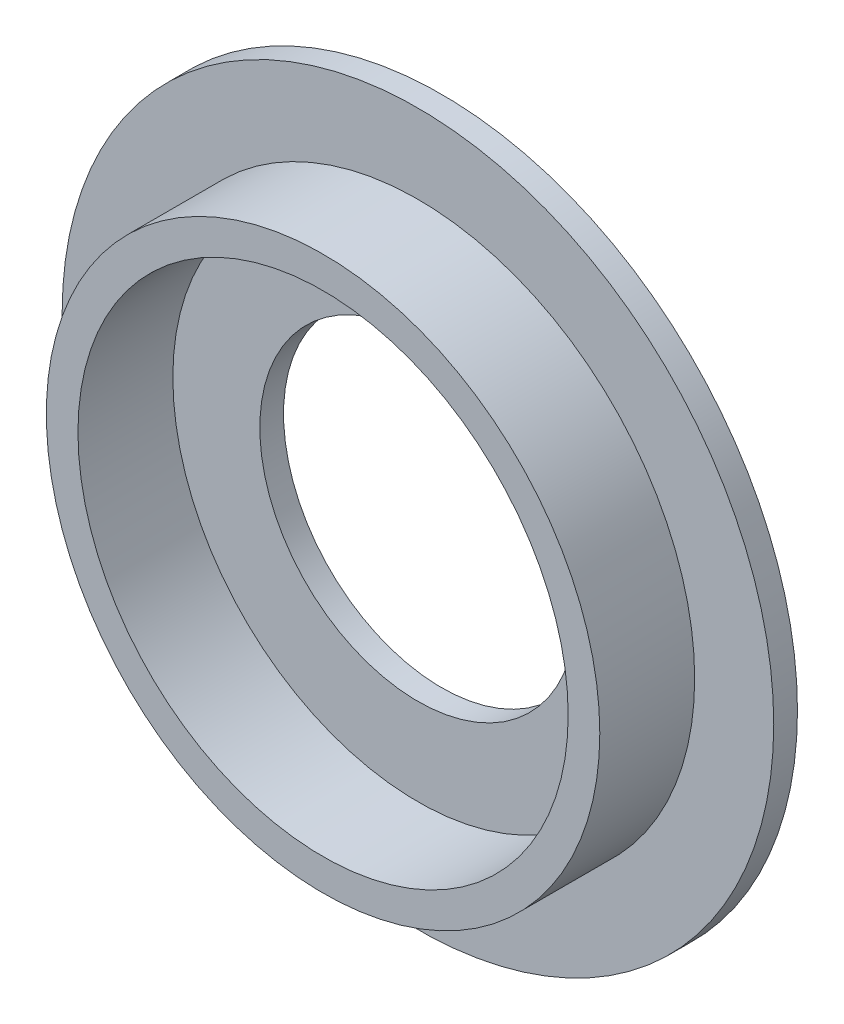
from build123d import *

# Parameters (mm, degrees)
SKETCH1_R           = 45
BOSS_EXTRUDE3_DEPTH = 3
SKETCH2_R           = 35
BOSS_EXTRUDE4_DEPTH = 12
SKETCH3_R           = 31
CUT_EXTRUDE2_DEPTH  = 12
SKETCH4_R           = 20
CUT_EXTRUDE3_DEPTH  = 8


with BuildPart() as part:
    # Sketch1 → Boss-Extrude3 (new body)
    with BuildSketch(Plane.XY):
        Circle(SKETCH1_R)
    extrude(amount=BOSS_EXTRUDE3_DEPTH)

    # Sketch2 → Boss-Extrude4 (add)
    with BuildSketch(Plane.XY.offset(3)):
        Circle(SKETCH2_R)
    extrude(amount=BOSS_EXTRUDE4_DEPTH)

    # Sketch3 → Cut-Extrude2 (cut)
    with BuildSketch(Plane.XY.offset(15)):
        Circle(SKETCH3_R)
    extrude(amount=-CUT_EXTRUDE2_DEPTH, mode=Mode.SUBTRACT)

    # Sketch4 → Cut-Extrude3 (cut)
    with BuildSketch(Plane.XY.offset(3)):
        Circle(SKETCH4_R)
    extrude(amount=-CUT_EXTRUDE3_DEPTH, mode=Mode.SUBTRACT)


solid = part.part
